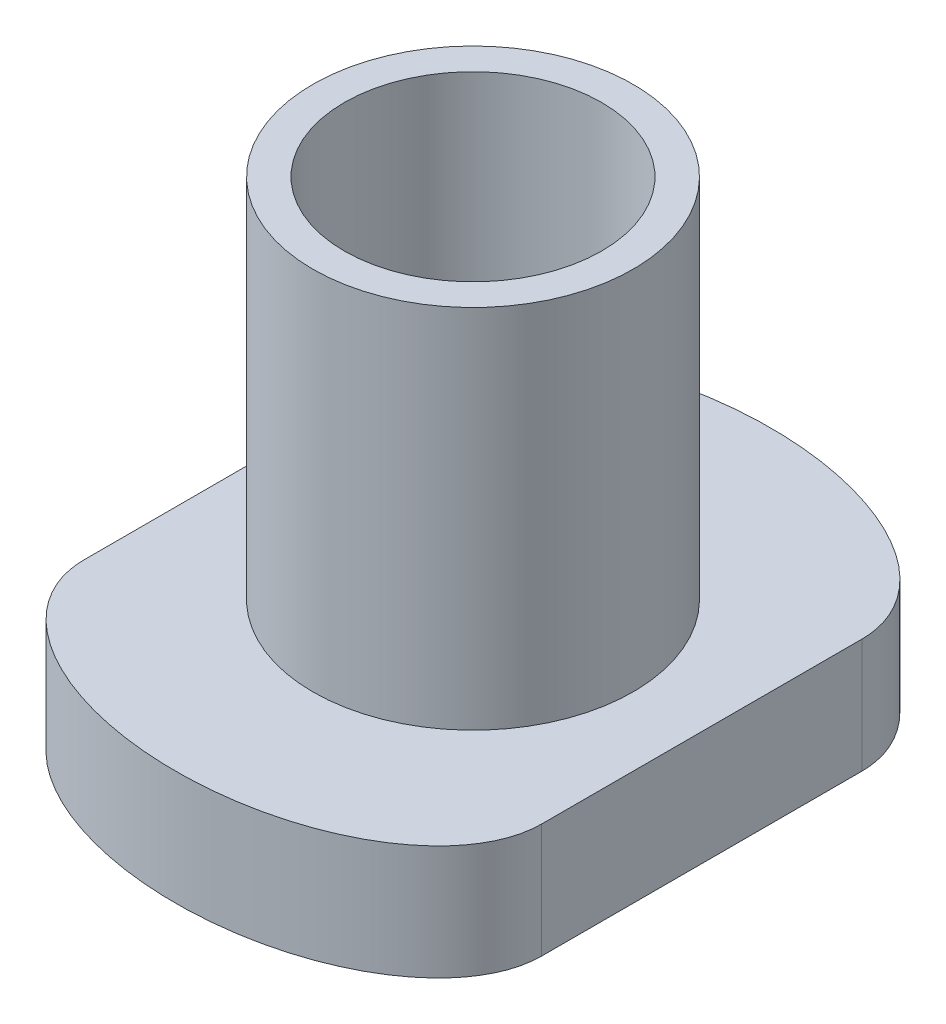
from build123d import *

# Parameters (mm, degrees)
BOSS_EXTRUDE1_DEPTH = 10
SKETCH2_R           = 14
BOSS_EXTRUDE2_DEPTH = 32
SKETCH3_R           = 11.25
CUT_EXTRUDE1_DEPTH  = 78.897368549


with BuildPart() as part:
    # Sketch1 → Boss-Extrude1 (new body)
    with BuildSketch(Plane(origin=(0, 0, 0), x_dir=(1, 0, 0), z_dir=(0, 1, 0))):
        with BuildLine():
            Line((0, 40), (0, 12))
            add(Edge.make_bspline(
                [(0, 12), (0, 0), (20, 0), (40, 0), (40, 12)],
                knots=[3.141592654, 3.141592654, 3.141592654, 4.71238898, 4.71238898, 6.283185307, 6.283185307, 6.283185307], degree=2, weights=[1, 0.707106781, 1, 0.707106781, 1]))
            Line((40, 12), (40, 40))
            add(Edge.make_bspline(
                [(40, 40), (40, 52), (20, 52), (0, 52), (0, 40)],
                knots=[3.141592654, 3.141592654, 3.141592654, 4.71238898, 4.71238898, 6.283185307, 6.283185307, 6.283185307], degree=2, weights=[1, 0.707106781, 1, 0.707106781, 1]))
        make_face()
    extrude(amount=BOSS_EXTRUDE1_DEPTH)

    # Sketch2 → Boss-Extrude2 (add)
    with BuildSketch(Plane(origin=(0, 10, 0), x_dir=(1, 0, 0), z_dir=(0, 1, 0))):
        with Locations(Location((20, 26, 0), (0, 0, 270))):
            Circle(SKETCH2_R)
    extrude(amount=BOSS_EXTRUDE2_DEPTH)

    # Sketch3 → Cut-Extrude1 (cut, through all)
    with BuildSketch(Plane(origin=(0, 42, 0), x_dir=(1, 0, 0), z_dir=(0, 1, 0))):
        with Locations(Location((20, 26, 0), (0, 0, 270))):
            Circle(SKETCH3_R)
    extrude(amount=-CUT_EXTRUDE1_DEPTH, mode=Mode.SUBTRACT)


solid = part.part
